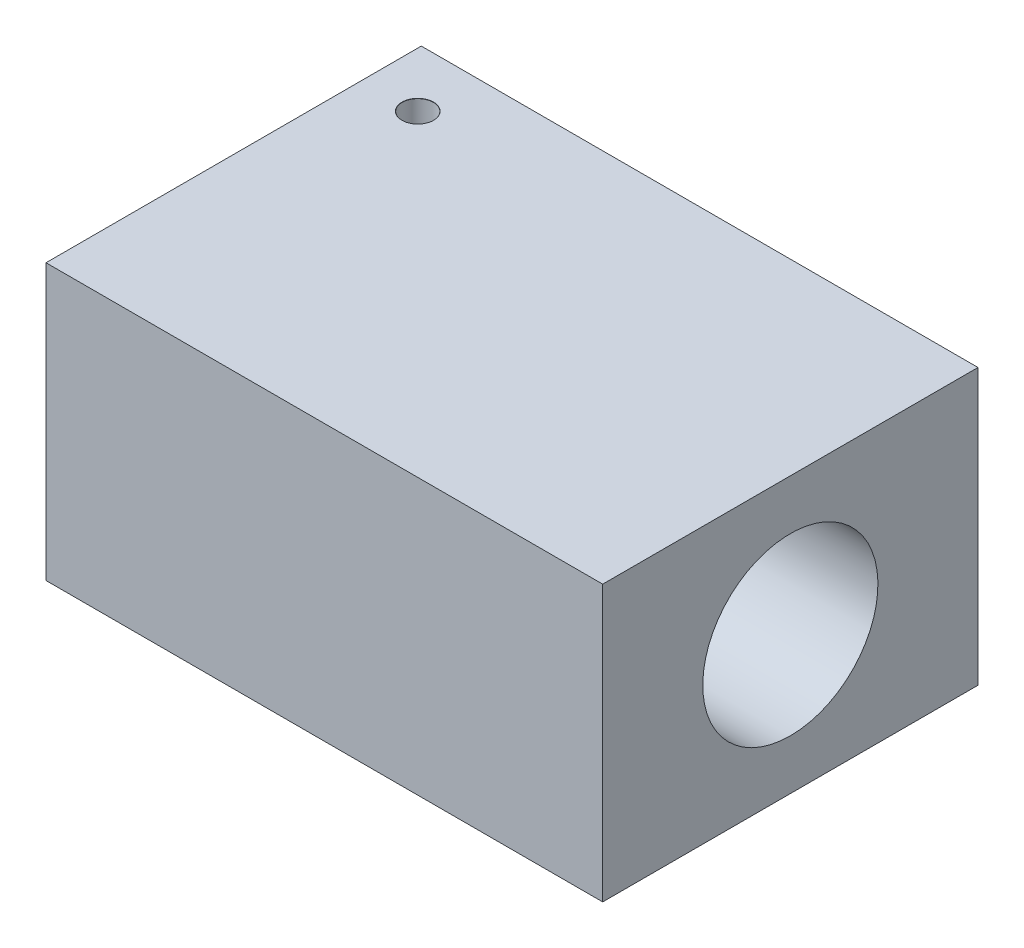
from build123d import *

# Parameters (mm, degrees)
SKETCH1_W                       = 89
SKETCH1_H                       = 44
BOSS_EXTRUDE1_DEPTH             = 30
SKETCH3_R                       = 14
CUT_EXTRUDE1_DEPTH              = 97.462427919
F_5_0MM_DOWEL_HOLE1_D           = 5
F_5_0MM_DOWEL_HOLE1_CSINK_D     = 5.05
F_5_0MM_DOWEL_HOLE1_CSINK_ANGLE = 90


with BuildPart() as part:
    # Sketch1 → Boss-Extrude1 (new, symmetric)
    with BuildSketch(Plane.XY):
        Rectangle(SKETCH1_W, SKETCH1_H)
    extrude(amount=BOSS_EXTRUDE1_DEPTH, both=True)

    # Sketch3 → Cut-Extrude1 (cut, through all)
    with BuildSketch(Plane.ZY.offset(44.5)):
        with Locations(Location((0, 0, 0), (0, 0, 270))):
            Circle(SKETCH3_R)
    extrude(amount=-CUT_EXTRUDE1_DEPTH, mode=Mode.SUBTRACT)

    # Ø5.0mm Dowel Hole1 (through all)
    with Locations(Plane(origin=(0, 22, 0), x_dir=(1, 0, 0), z_dir=(0, 1, 0))):
        with Locations((-35.759887734, 20.696035026)):
            CounterSinkHole(F_5_0MM_DOWEL_HOLE1_D / 2, F_5_0MM_DOWEL_HOLE1_CSINK_D / 2, counter_sink_angle=F_5_0MM_DOWEL_HOLE1_CSINK_ANGLE)


solid = part.part
